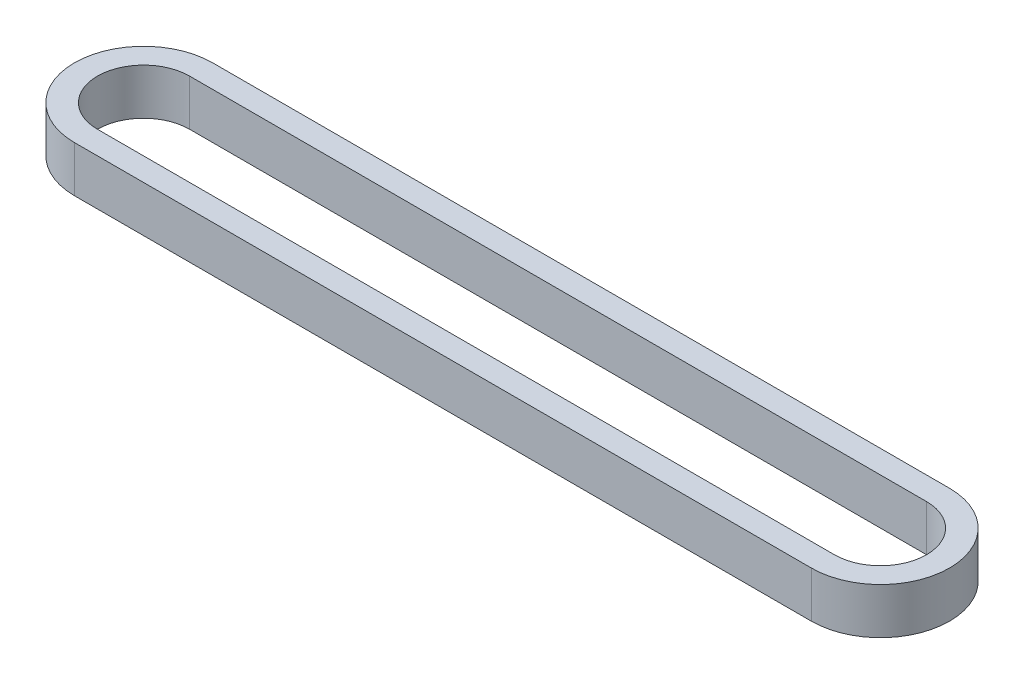
from build123d import *

# Parameters (mm, degrees)
EXTRUDE_1_DEPTH = 2


with BuildPart() as part:
    # 草图1 → 凸台-拉伸1 (new body)
    with BuildSketch(Plane(origin=(0, 0, 0), x_dir=(1, 0, 0), z_dir=(0, 1, 0))):
        with BuildLine():
            Line((-16, 3), (16, 3))
            ThreePointArc((16, 3), (19, 0), (16, -3))
            Line((16, -3), (-16, -3))
            ThreePointArc((-16, -3), (-19, 0), (-16, 3))
        make_face()
        with BuildLine():
            Line((-16, 2), (16, 2))
            ThreePointArc((16, 2), (18, 0), (16, -2))
            Line((16, -2), (-16, -2))
            ThreePointArc((-16, -2), (-18, 0), (-16, 2))
        make_face(mode=Mode.SUBTRACT)
    extrude(amount=EXTRUDE_1_DEPTH)


solid = part.part
